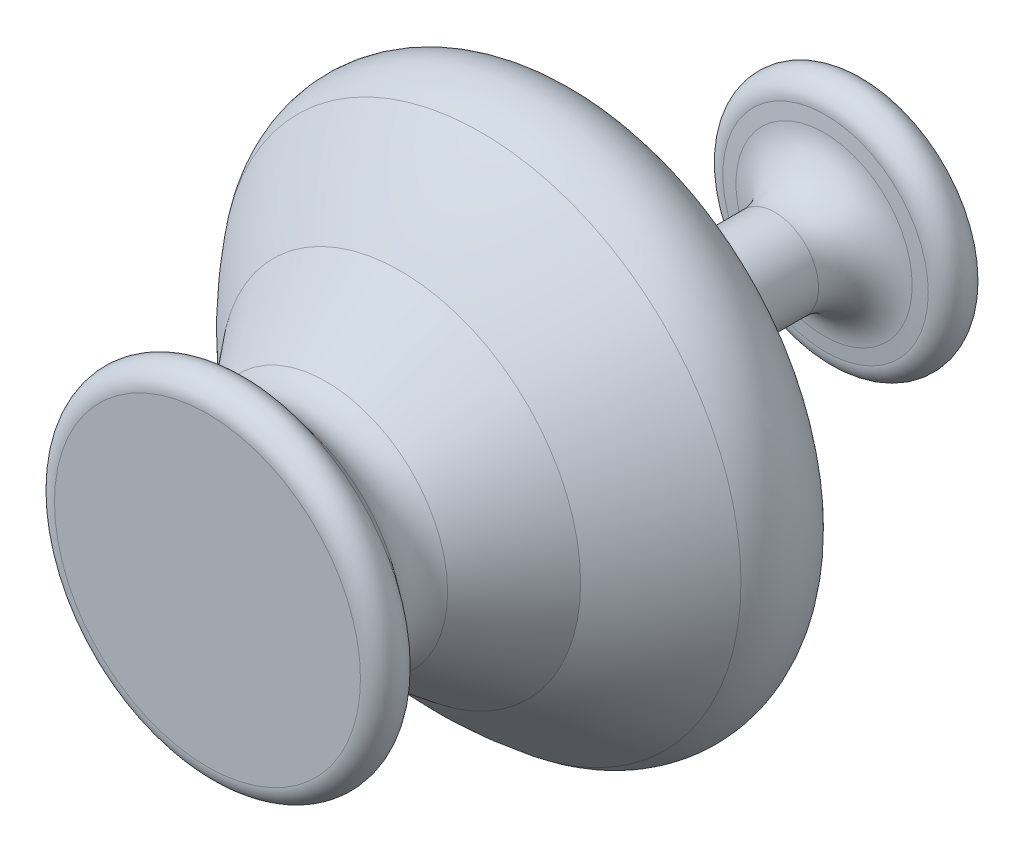
from build123d import *


with BuildPart() as part:
    # Sketch1 → Revolve3 (revolve)
    with BuildSketch(Plane(origin=(0, 0, 0), x_dir=(1, 0, 0), z_dir=(0, 1, 0)), mode=Mode.PRIVATE) as revolve3_sk:
        with BuildLine():
            Line((0, 0), (-37.129195983, 0))
            ThreePointArc((-37.129195983, 0), (-41.855007756, 3.366995689), (-40.216104383, 8.933318768))
            Line((-40.216104383, 8.933318768), (-31.028855304, 16.14356488))
            ThreePointArc((-31.028855304, 16.14356488), (-27.65, 22.146234143), (-29.505316643, 28.779973782))
            Line((-29.505316643, 28.779973782), (-43.696570683, 46.862378123))
            ThreePointArc((-43.696570683, 46.862378123), (-53.916027764, 56.106054849), (-63.054105157, 66.420045542))
            ThreePointArc((-63.054105157, 66.420045542), (-66.204638247, 79.468222648), (-58.309368742, 90.323889555))
            Line((-58.309368742, 90.323889555), (-16.751084364, 113.521924993))
            ThreePointArc((-16.751084364, 113.521924993), (-12.25140136, 117.92493368), (-10.6, 124.000006205))
            Line((-10.6, 124.000006205), (-10.6, 137.700006205))
            ThreePointArc((-10.6, 137.700006205), (-13.693812308, 145.742382769), (-21.379970133, 149.6378254))
            Line((-21.379970133, 149.6378254), (-24.923797222, 150))
            ThreePointArc((-24.923797222, 150), (-29.923797222, 155.000003825), (-24.923789573, 160))
            Line((-24.923789573, 160), (-14.423797222, 160))
            Line((-14.423797222, 160), (-14.423797222, 155.6))
            Line((-14.423797222, 155.6), (-24.923796304, 155.6))
            ThreePointArc((-24.923796304, 155.6), (-25.521002945, 154.94216123), (-24.808657506, 154.411151254))
            Line((-24.808657506, 154.411151254), (-20.932625848, 154.015025771))
            ThreePointArc((-20.932625848, 154.015025771), (-10.428210154, 148.691254176), (-6.2, 137.700006205))
            Line((-6.2, 137.700006205), (-6.2, 124.000006205))
            ThreePointArc((-6.2, 124.000006205), (-8.456915192, 115.697407088), (-14.606481965, 109.679961882))
            Line((-14.606481965, 109.679961882), (-56.164766342, 86.481926444))
            ThreePointArc((-56.164766342, 86.481926444), (-61.888836733, 78.611567936), (-59.604700243, 69.151639534))
            ThreePointArc((-59.604700243, 69.151639534), (-50.615076995, 59.026124681), (-40.545379217, 49.97402195))
            Line((-40.545379217, 49.97402195), (-26.043996127, 31.496453174))
            ThreePointArc((-26.043996127, 31.496453174), (-23.281635792, 21.619551933), (-28.312375912, 12.682244364))
            Line((-28.312375912, 12.682244364), (-37.499624991, 5.471998252))
            ThreePointArc((-37.499624991, 5.471998252), (-37.696293395, 4.804039483), (-37.129195983, 4.4))
            Line((-37.129195983, 4.4), (0, 4.4))
            Line((0, 4.4), (0, 0))
        make_face()
    revolve(revolve3_sk.sketch.rotate(Axis((0, 0, 0), (0, 0, -1)), 180), axis=Axis((0, 0, 0), (0, 0, -1)))


solid = part.part
